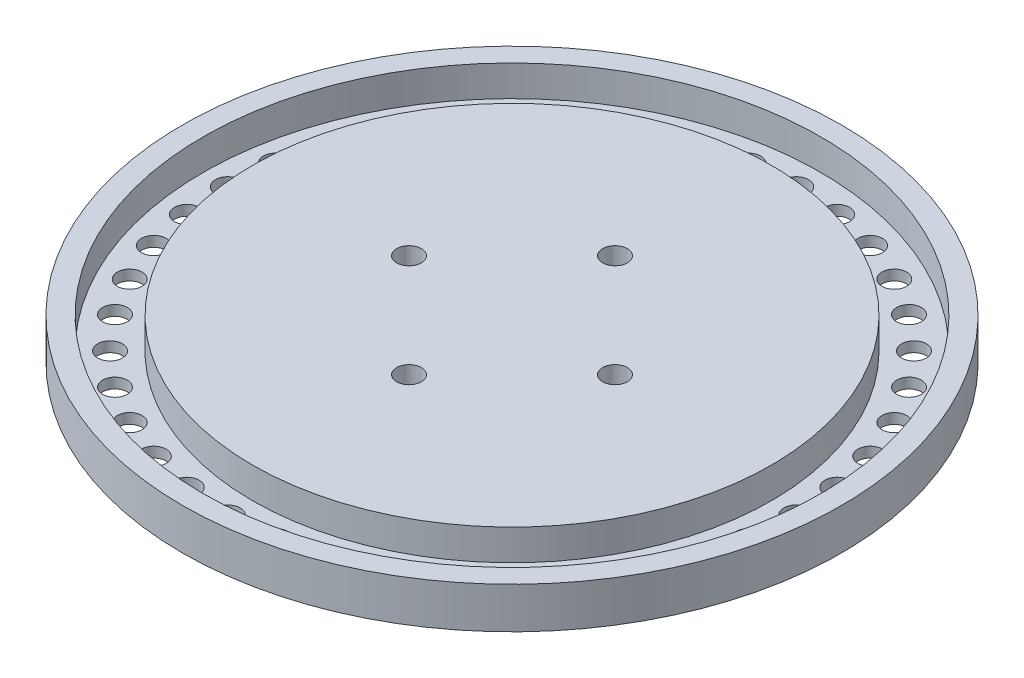
from build123d import *

# Parameters (mm, degrees)
SKETCH1_R           = 40
SKETCH1_R_2         = 1.5
BOSS_EXTRUDE1_DEPTH = 5
SKETCH2_R           = 37.5
SKETCH2_R_2         = 31.5
CUT_EXTRUDE1_DEPTH  = 3.75


with BuildPart() as part:
    # Sketch1 → Boss-Extrude1 (new body)
    with BuildSketch(Plane(origin=(0, 0, 0), x_dir=(1, 0, 0), z_dir=(0, 1, 0))):
        with Locations(Location((0, 0, 0), (0, 0, 270))):
            Circle(SKETCH1_R)
        with Locations(Location((0, -34.5, 0), (0, 0, 270))):
            Circle(SKETCH1_R_2, mode=Mode.SUBTRACT)
        with Locations(Location((-5.396989044, -34.075247751, 0), (0, 0, 270))):
            Circle(SKETCH1_R_2, mode=Mode.SUBTRACT)
        with Locations(Location((-10.661086306, -32.811449812, 0), (0, 0, 270))):
            Circle(SKETCH1_R_2, mode=Mode.SUBTRACT)
        with Locations(Location((-15.662672241, -30.739725084, 0), (0, 0, 270))):
            Circle(SKETCH1_R_2, mode=Mode.SUBTRACT)
        with Locations(Location((-20.278591204, -27.911086306, 0), (0, 0, 270))):
            Circle(SKETCH1_R_2, mode=Mode.SUBTRACT)
        with Locations(Location((-24.395183951, -24.395183951, 0), (0, 0, 270))):
            Circle(SKETCH1_R_2, mode=Mode.SUBTRACT)
        with Locations(Location((-27.911086306, -20.278591204, 0), (0, 0, 270))):
            Circle(SKETCH1_R_2, mode=Mode.SUBTRACT)
        with Locations(Location((-30.739725084, -15.662672241, 0), (0, 0, 270))):
            Circle(SKETCH1_R_2, mode=Mode.SUBTRACT)
        with Locations(Location((-32.811449812, -10.661086306, 0), (0, 0, 270))):
            Circle(SKETCH1_R_2, mode=Mode.SUBTRACT)
        with Locations(Location((-34.075247751, -5.396989044, 0), (0, 0, 270))):
            Circle(SKETCH1_R_2, mode=Mode.SUBTRACT)
        with Locations(Location((-34.5, 0, 0), (0, 0, 270))):
            Circle(SKETCH1_R_2, mode=Mode.SUBTRACT)
        with Locations(Location((-34.075247751, 5.396989044, 0), (0, 0, 270))):
            Circle(SKETCH1_R_2, mode=Mode.SUBTRACT)
        with Locations(Location((-32.811449812, 10.661086306, 0), (0, 0, 270))):
            Circle(SKETCH1_R_2, mode=Mode.SUBTRACT)
        with Locations(Location((-30.739725084, 15.662672241, 0), (0, 0, 270))):
            Circle(SKETCH1_R_2, mode=Mode.SUBTRACT)
        with Locations(Location((-27.911086306, 20.278591204, 0), (0, 0, 270))):
            Circle(SKETCH1_R_2, mode=Mode.SUBTRACT)
        with Locations(Location((-24.395183951, 24.395183951, 0), (0, 0, 270))):
            Circle(SKETCH1_R_2, mode=Mode.SUBTRACT)
        with Locations(Location((-20.278591204, 27.911086306, 0), (0, 0, 270))):
            Circle(SKETCH1_R_2, mode=Mode.SUBTRACT)
        with Locations(Location((-15.662672241, 30.739725084, 0), (0, 0, 270))):
            Circle(SKETCH1_R_2, mode=Mode.SUBTRACT)
        with Locations(Location((-10.661086306, 32.811449812, 0), (0, 0, 270))):
            Circle(SKETCH1_R_2, mode=Mode.SUBTRACT)
        with Locations(Location((-5.396989044, 34.075247751, 0), (0, 0, 270))):
            Circle(SKETCH1_R_2, mode=Mode.SUBTRACT)
        with Locations(Location((0, 34.5, 0), (0, 0, 270))):
            Circle(SKETCH1_R_2, mode=Mode.SUBTRACT)
        with Locations(Location((5.396989044, 34.075247751, 0), (0, 0, 270))):
            Circle(SKETCH1_R_2, mode=Mode.SUBTRACT)
        with Locations(Location((10.661086306, 32.811449812, 0), (0, 0, 270))):
            Circle(SKETCH1_R_2, mode=Mode.SUBTRACT)
        with Locations(Location((15.662672241, 30.739725084, 0), (0, 0, 270))):
            Circle(SKETCH1_R_2, mode=Mode.SUBTRACT)
        with Locations(Location((20.278591204, 27.911086306, 0), (0, 0, 270))):
            Circle(SKETCH1_R_2, mode=Mode.SUBTRACT)
        with Locations(Location((24.395183951, 24.395183951, 0), (0, 0, 270))):
            Circle(SKETCH1_R_2, mode=Mode.SUBTRACT)
        with Locations(Location((27.911086306, 20.278591204, 0), (0, 0, 270))):
            Circle(SKETCH1_R_2, mode=Mode.SUBTRACT)
        with Locations(Location((30.739725084, 15.662672241, 0), (0, 0, 270))):
            Circle(SKETCH1_R_2, mode=Mode.SUBTRACT)
        with Locations(Location((32.811449812, 10.661086306, 0), (0, 0, 270))):
            Circle(SKETCH1_R_2, mode=Mode.SUBTRACT)
        with Locations(Location((34.075247751, 5.396989044, 0), (0, 0, 270))):
            Circle(SKETCH1_R_2, mode=Mode.SUBTRACT)
        with Locations(Location((34.5, 0, 0), (0, 0, 270))):
            Circle(SKETCH1_R_2, mode=Mode.SUBTRACT)
        with Locations(Location((34.075247751, -5.396989044, 0), (0, 0, 270))):
            Circle(SKETCH1_R_2, mode=Mode.SUBTRACT)
        with Locations(Location((32.811449812, -10.661086306, 0), (0, 0, 270))):
            Circle(SKETCH1_R_2, mode=Mode.SUBTRACT)
        with Locations(Location((30.739725084, -15.662672241, 0), (0, 0, 270))):
            Circle(SKETCH1_R_2, mode=Mode.SUBTRACT)
        with Locations(Location((27.911086306, -20.278591204, 0), (0, 0, 270))):
            Circle(SKETCH1_R_2, mode=Mode.SUBTRACT)
        with Locations(Location((24.395183951, -24.395183951, 0), (0, 0, 270))):
            Circle(SKETCH1_R_2, mode=Mode.SUBTRACT)
        with Locations(Location((20.278591204, -27.911086306, 0), (0, 0, 270))):
            Circle(SKETCH1_R_2, mode=Mode.SUBTRACT)
        with Locations(Location((15.662672241, -30.739725084, 0), (0, 0, 270))):
            Circle(SKETCH1_R_2, mode=Mode.SUBTRACT)
        with Locations(Location((10.661086306, -32.811449812, 0), (0, 0, 270))):
            Circle(SKETCH1_R_2, mode=Mode.SUBTRACT)
        with Locations(Location((5.396989044, -34.075247751, 0), (0, 0, 270))):
            Circle(SKETCH1_R_2, mode=Mode.SUBTRACT)
        with Locations(Location((0, -12.5, 0), (0, 0, 270))):
            Circle(SKETCH1_R_2, mode=Mode.SUBTRACT)
        with Locations(Location((-12.5, 0, 0), (0, 0, 270))):
            Circle(SKETCH1_R_2, mode=Mode.SUBTRACT)
        with Locations(Location((0, 12.5, 0), (0, 0, 270))):
            Circle(SKETCH1_R_2, mode=Mode.SUBTRACT)
        with Locations(Location((12.5, 0, 0), (0, 0, 270))):
            Circle(SKETCH1_R_2, mode=Mode.SUBTRACT)
    extrude(amount=BOSS_EXTRUDE1_DEPTH)

    # Sketch2 → Cut-Extrude1 (cut)
    with BuildSketch(Plane(origin=(0, 5, 0), x_dir=(1, 0, 0), z_dir=(0, 1, 0))):
        with Locations(Location((0, 0, 0), (0, 0, 270))):
            Circle(SKETCH2_R)
        with Locations(Location((0, 0, 0), (0, 0, 270))):
            Circle(SKETCH2_R_2, mode=Mode.SUBTRACT)
    extrude(amount=-CUT_EXTRUDE1_DEPTH, mode=Mode.SUBTRACT)


solid = part.part
